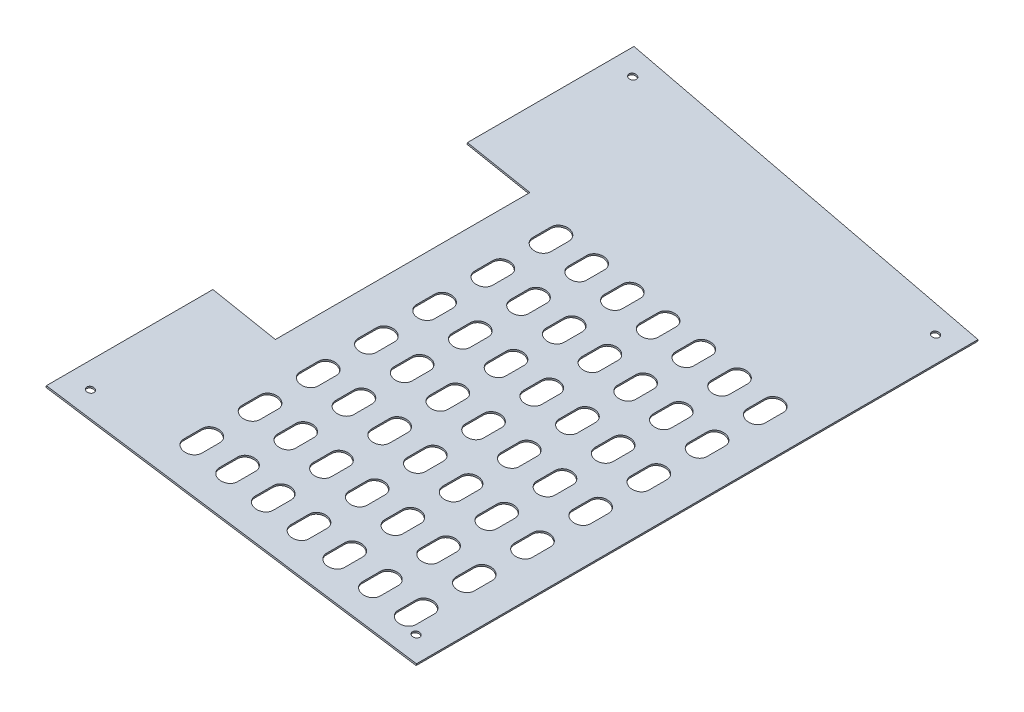
from build123d import *

# Parameters (mm, degrees)
BOSS_EXTRUDE1_START  = 1.5
BOSS_EXTRUDE1_DEPTH  = 1
SKETCH3_W            = 70
SKETCH3_H            = 140
CUT_EXTRUDE1_DEPTH   = 10
SKETCH4_R            = 2
CUT_EXTRUDE2_DEPTH   = 10
CUT_EXTRUDE3_DEPTH   = 10
LPATTERN1_COUNT      = 7
LPATTERN1_PITCH      = 32
LPATTERN1_COUNT_DIR2 = 7
LPATTERN1_PITCH_DIR2 = 20


with BuildPart() as part:
    # Sketch2 → Boss-Extrude1 (new body)
    with BuildSketch(Plane(origin=(150.585220063, 781.874328174, 0), x_dir=(-0.981954058558615, 0.1891196099833757, 0), z_dir=(-0.18911960998337574, -0.9819540585586151, 0)).offset(BOSS_EXTRUDE1_START)):
        Polygon((-860.761163517, 154.396631655), (-660.761163517, 161.576287246), (-660.761163517, -161.576287246), (-860.761163517, -154.396631655), align=None)
    extrude(amount=-BOSS_EXTRUDE1_DEPTH)

    # Sketch3 → Cut-Extrude1 (cut)
    with BuildSketch(Plane(origin=(150.490660258, 781.383351145, 0), x_dir=(0.981954058558615, -0.18911960998337574, 0), z_dir=(0.18911960998337574, 0.981954058558615, 0))):
        with Locations((660.761163517, 0)):
            Rectangle(SKETCH3_W, SKETCH3_H)
    extrude(amount=-CUT_EXTRUDE1_DEPTH, mode=Mode.SUBTRACT)

    # Sketch4 → Cut-Extrude2 (cut)
    with BuildSketch(Plane(origin=(150.490660258, 781.383351145, 0), x_dir=(0.981954058558615, -0.18911960998337574, 0), z_dir=(0.18911960998337574, 0.981954058558615, 0))):
        with Locations(Location((672.761163517, 149.137778282, 0), (0, 0, 180))):
            Circle(SKETCH4_R)
        with Locations(Location((848.761163517, 142.819681361, 0), (0, 0, 180))):
            Circle(SKETCH4_R)
    cut_extrude2 = extrude(amount=-CUT_EXTRUDE2_DEPTH, mode=Mode.SUBTRACT)

    # Mirror1: Cut-Extrude2 across plane
    add(cut_extrude2.mirror(Plane.XY), mode=Mode.SUBTRACT)

    # Sketch5 → Cut-Extrude3 (cut)
    with BuildSketch(Plane(origin=(150.490660258, 781.383351145, 0), x_dir=(0.981954058558615, -0.18911960998337574, 0), z_dir=(0.18911960998337574, 0.981954058558615, 0))):
        with BuildLine():
            Line((844.690941862, 63.083635575), (844.690941862, 53.083635575))
            ThreePointArc((844.690941862, 53.083635575), (839.690941862, 48.083635575), (834.690941862, 53.083635575))
            Line((834.690941862, 53.083635575), (834.690941862, 63.083635575))
            ThreePointArc((834.690941862, 63.083635575), (839.690941862, 68.083635575), (844.690941862, 63.083635575))
        make_face()
    cut_extrude3 = extrude(amount=-CUT_EXTRUDE3_DEPTH, mode=Mode.SUBTRACT)

    # LPattern1: Cut-Extrude3 7 × 7
    with Locations(*[Vector(0, 0, 1) * (i * LPATTERN1_PITCH) + Vector(-0.9819540585586151, 0.1891196099833758, 0) * (j * LPATTERN1_PITCH_DIR2) for i in range(LPATTERN1_COUNT) for j in range(LPATTERN1_COUNT_DIR2) if (i, j) != (0, 0)]):
        add(cut_extrude3, mode=Mode.SUBTRACT)


solid = part.part
